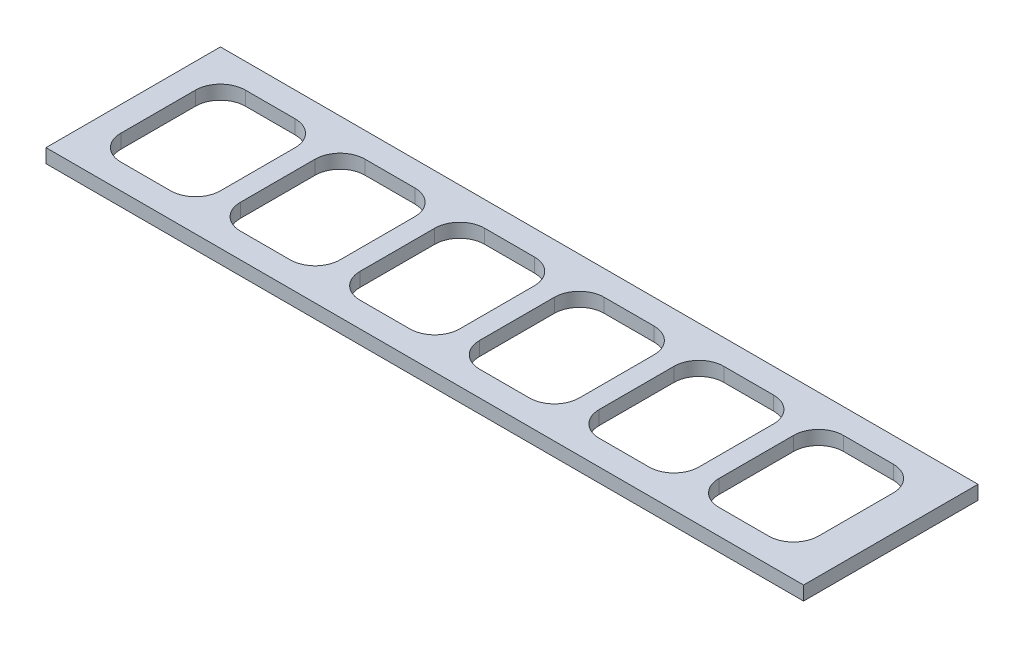
from build123d import *

# Parameters (mm, degrees)
SKETCH1_W           = 386.08
SKETCH1_H           = 88.9
BOSS_EXTRUDE1_DEPTH = 7.112


with BuildPart() as part:
    # Sketch1 → Boss-Extrude1 (new body)
    with BuildSketch(Plane(origin=(0, 0, 0), x_dir=(1, 0, 0), z_dir=(0, 1, 0))):
        with Locations((193.04, 44.45)):
            Rectangle(SKETCH1_W, SKETCH1_H)
        with BuildLine():
            Line((73.66, 63.5), (73.66, 25.4))
            ThreePointArc((73.66, 25.4), (77.379743879, 16.419743879), (86.36, 12.7))
            Line((86.36, 12.7), (111.76, 12.7))
            ThreePointArc((111.76, 12.7), (120.740256121, 16.419743879), (124.46, 25.4))
            Line((124.46, 25.4), (124.46, 63.5))
            ThreePointArc((124.46, 63.5), (120.740256121, 72.480256121), (111.76, 76.2))
            Line((111.76, 76.2), (86.36, 76.2))
            ThreePointArc((86.36, 76.2), (77.379743879, 72.480256121), (73.66, 63.5))
        make_face(mode=Mode.SUBTRACT)
        with BuildLine():
            Line((25.4, 76.2), (50.8, 76.2))
            ThreePointArc((50.8, 76.2), (59.780256121, 72.480256121), (63.5, 63.5))
            Line((63.5, 63.5), (63.5, 25.4))
            ThreePointArc((63.5, 25.4), (59.780256121, 16.419743879), (50.8, 12.7))
            Line((50.8, 12.7), (25.4, 12.7))
            ThreePointArc((25.4, 12.7), (16.419743879, 16.419743879), (12.7, 25.4))
            Line((12.7, 25.4), (12.7, 63.5))
            ThreePointArc((12.7, 63.5), (16.419743879, 72.480256121), (25.4, 76.2))
        make_face(mode=Mode.SUBTRACT)
        with BuildLine():
            Line((134.62, 63.5), (134.62, 25.4))
            ThreePointArc((134.62, 25.4), (138.339743879, 16.419743879), (147.32, 12.7))
            Line((147.32, 12.7), (172.72, 12.7))
            ThreePointArc((172.72, 12.7), (181.700256121, 16.419743879), (185.42, 25.4))
            Line((185.42, 25.4), (185.42, 63.5))
            ThreePointArc((185.42, 63.5), (181.700256121, 72.480256121), (172.72, 76.2))
            Line((172.72, 76.2), (147.32, 76.2))
            ThreePointArc((147.32, 76.2), (138.339743879, 72.480256121), (134.62, 63.5))
        make_face(mode=Mode.SUBTRACT)
        with BuildLine():
            Line((195.58, 63.5), (195.58, 25.4))
            ThreePointArc((195.58, 25.4), (199.299743879, 16.419743879), (208.28, 12.7))
            Line((208.28, 12.7), (233.68, 12.7))
            ThreePointArc((233.68, 12.7), (242.660256121, 16.419743879), (246.38, 25.4))
            Line((246.38, 25.4), (246.38, 63.5))
            ThreePointArc((246.38, 63.5), (242.660256121, 72.480256121), (233.68, 76.2))
            Line((233.68, 76.2), (208.28, 76.2))
            ThreePointArc((208.28, 76.2), (199.299743879, 72.480256121), (195.58, 63.5))
        make_face(mode=Mode.SUBTRACT)
        with BuildLine():
            Line((256.54, 63.5), (256.54, 25.4))
            ThreePointArc((256.54, 25.4), (260.259743879, 16.419743879), (269.24, 12.7))
            Line((269.24, 12.7), (294.64, 12.7))
            ThreePointArc((294.64, 12.7), (303.620256121, 16.419743879), (307.34, 25.4))
            Line((307.34, 25.4), (307.34, 63.5))
            ThreePointArc((307.34, 63.5), (303.620256121, 72.480256121), (294.64, 76.2))
            Line((294.64, 76.2), (269.24, 76.2))
            ThreePointArc((269.24, 76.2), (260.259743879, 72.480256121), (256.54, 63.5))
        make_face(mode=Mode.SUBTRACT)
        with BuildLine():
            Line((317.5, 63.5), (317.5, 25.4))
            ThreePointArc((317.5, 25.4), (321.219743879, 16.419743879), (330.2, 12.7))
            Line((330.2, 12.7), (355.6, 12.7))
            ThreePointArc((355.6, 12.7), (364.580256121, 16.419743879), (368.3, 25.4))
            Line((368.3, 25.4), (368.3, 63.5))
            ThreePointArc((368.3, 63.5), (364.580256121, 72.480256121), (355.6, 76.2))
            Line((355.6, 76.2), (330.2, 76.2))
            ThreePointArc((330.2, 76.2), (321.219743879, 72.480256121), (317.5, 63.5))
        make_face(mode=Mode.SUBTRACT)
    extrude(amount=BOSS_EXTRUDE1_DEPTH)


solid = part.part
